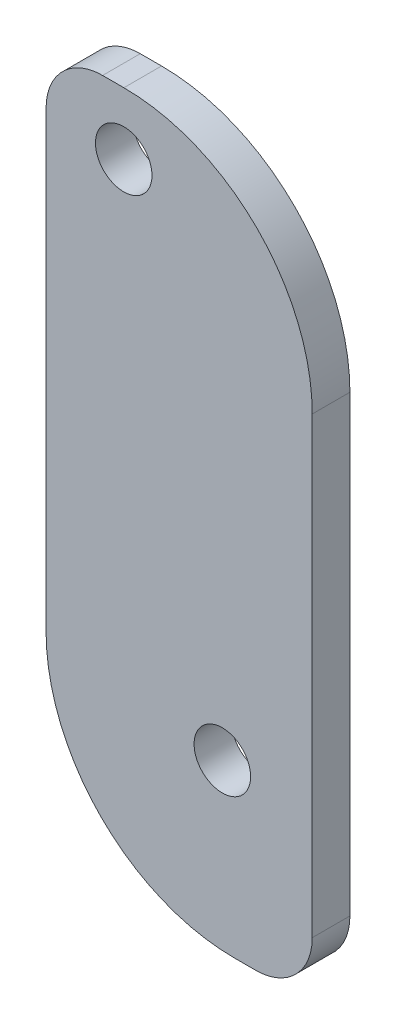
from build123d import *

# Parameters (mm, degrees)
ESBO_O1_R                = 1.5
RESSALTO_EXTRUS_O1_DEPTH = 2


with BuildPart() as part:
    # Esboço1 → Ressalto-extrusão1 (new body)
    with BuildSketch(Plane.XY):
        with BuildLine():
            Line((-1.121038668, 3.291347086), (0.008712569, 3.291347086))
            ThreePointArc((0.008712569, 3.291347086), (7.079780381, 0.362414898), (10.008712569, -6.708652914))
            Line((10.008712569, -6.708652914), (10.008712569, -30.785558293))
            ThreePointArc((10.008712569, -30.785558293), (9.130032913, -32.906878637), (7.008712569, -33.785558293))
            Line((7.008712569, -33.785558293), (5.878961332, -33.785558293))
            ThreePointArc((5.878961332, -33.785558293), (-1.19210648, -30.856626105), (-4.121038668, -23.785558293))
            Line((-4.121038668, -23.785558293), (-4.121038668, 0.291347086))
            ThreePointArc((-4.121038668, 0.291347086), (-3.242359012, 2.41266743), (-1.121038668, 3.291347086))
        make_face()
        Circle(ESBO_O1_R, mode=Mode.SUBTRACT)
        with Locations((5.236066432, -25.02000308)):
            Circle(ESBO_O1_R, mode=Mode.SUBTRACT)
    extrude(amount=RESSALTO_EXTRUS_O1_DEPTH)


solid = part.part
